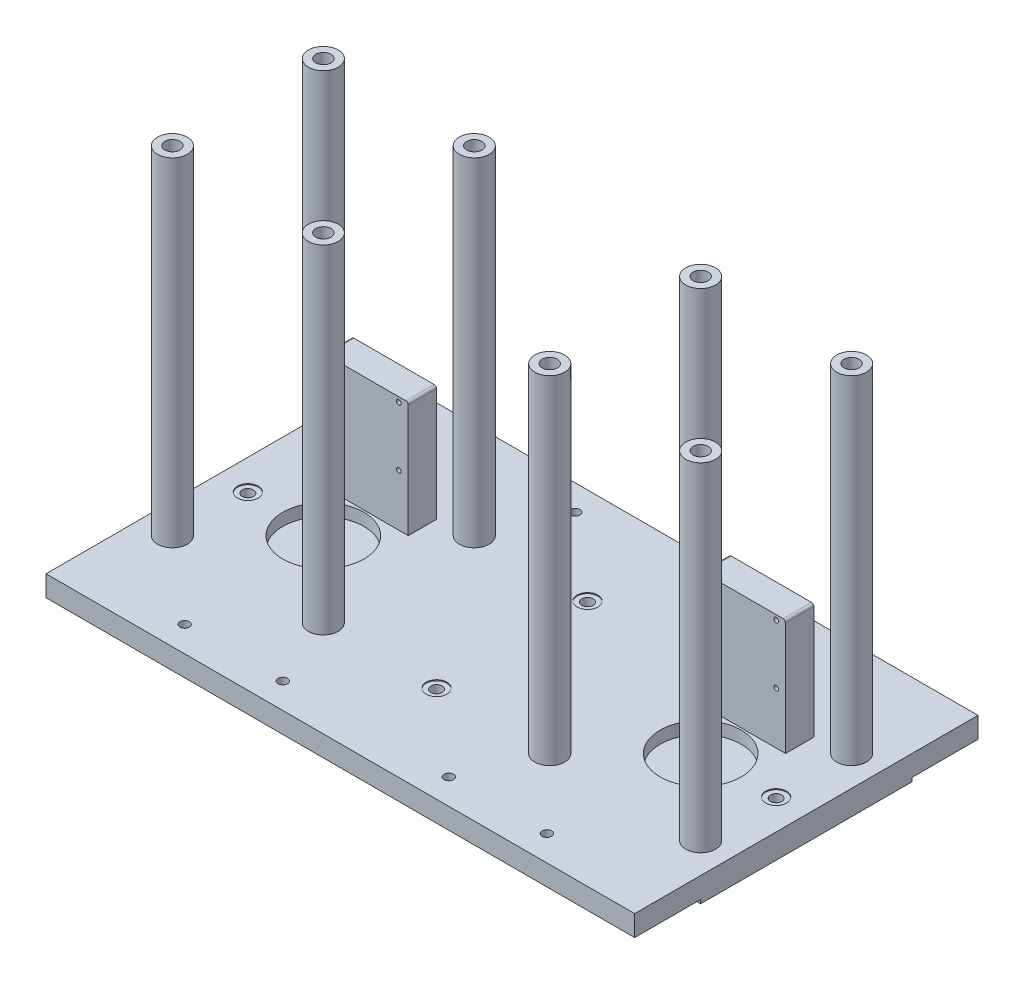
from build123d import *

# Parameters (mm, degrees)
SKETCH_1_W                    = 312
SKETCH_1_H                    = 112
EXTRUDE_1_DEPTH               = 2
SKETCH_2_W                    = 312
SKETCH_2_H                    = 182
EXTRUDE_2_DEPTH               = 11
SKETCH_3_R                    = 7.9
EXTRUDE_3_DEPTH               = 179
EXTRUDE_3_2_DEPTH             = 179
EXTRUDE_3_3_DEPTH             = 179
EXTRUDE_3_4_DEPTH             = 179
EXTRUDE_3_5_DEPTH             = 179
EXTRUDE_3_6_DEPTH             = 179
EXTRUDE_3_7_DEPTH             = 179
EXTRUDE_3_8_DEPTH             = 179
SKETCH_4_R                    = 21.5
CUT_EXTRUDE_2_DEPTH           = 6.5
HOLE_WIZARD_M5_1_AT_2_COUNT   = 2
HOLE_WIZARD_M5_1_AT_2_PITCH   = 52
HOLE_WIZARD_M5_1_AT_3_COUNT   = 2
HOLE_WIZARD_M5_1_AT_3_PITCH   = 163.49006086
HOLE_WIZARD_M5_1_AT_4_COUNT   = 2
HOLE_WIZARD_M5_1_AT_4_PITCH   = 155
HOLE_WIZARD_M5_1_2_AT_2_COUNT = 2
HOLE_WIZARD_M5_1_2_AT_2_PITCH = 145.602197786
HOLE_WIZARD_M5_1_2_AT_3_COUNT = 2
HOLE_WIZARD_M5_1_2_AT_3_PITCH = 145.602197786
HOLE_WIZARD_M5_1_2_AT_4_COUNT = 2
HOLE_WIZARD_M5_1_2_AT_4_PITCH = 280
HOLE_WIZARD_M8_1_AT_2_COUNT   = 2
HOLE_WIZARD_M8_1_AT_2_PITCH   = 80
HOLE_WIZARD_M8_1_AT_3_COUNT   = 2
HOLE_WIZARD_M8_1_AT_3_PITCH   = 113.13708499
HOLE_WIZARD_M8_1_AT_4_COUNT   = 2
HOLE_WIZARD_M8_1_AT_4_PITCH   = 80
HOLE_WIZARD_M8_1_AT_5_COUNT   = 2
HOLE_WIZARD_M8_1_AT_5_PITCH   = 200
HOLE_WIZARD_M8_1_AT_6_COUNT   = 2
HOLE_WIZARD_M8_1_AT_6_PITCH   = 280
HOLE_WIZARD_M8_1_AT_7_COUNT   = 2
HOLE_WIZARD_M8_1_AT_7_PITCH   = 291.204395571
HOLE_WIZARD_M8_1_AT_8_COUNT   = 2
HOLE_WIZARD_M8_1_AT_8_PITCH   = 215.406592285
SKETCH_31_W                   = 45
SKETCH_31_H                   = 15
EXTRUDE_4_DEPTH               = 61.25
SKETCH_32_R                   = 1.25
CUT_EXTRUDE_3_DEPTH           = 273.180546696
FILLET_1_R                    = 1.25
FILLET_1_OF_MIRROR_1_R        = 1.25


with BuildPart() as part:
    # 草图1 → 凸台-拉伸1 (new body)
    with BuildSketch(Plane(origin=(0, 0, 0), x_dir=(1, 0, 0), z_dir=(0, 1, 0))):
        Rectangle(SKETCH_1_W, SKETCH_1_H)
    extrude(amount=EXTRUDE_1_DEPTH)

    # 草图2 → 凸台-拉伸2 (add)
    with BuildSketch(Plane(origin=(0, 2, 0), x_dir=(1, 0, 0), z_dir=(0, 1, 0))):
        Rectangle(SKETCH_2_W, SKETCH_2_H)
    extrude(amount=EXTRUDE_2_DEPTH)

    # 草图4 → 切除-拉伸2 (cut)
    with BuildSketch(Plane(origin=(0, 13, 0), x_dir=(1, 0, 0), z_dir=(0, 1, 0))):
        with Locations(Location((-100, 0, 0), (0, 0, 270))):
            Circle(SKETCH_4_R)
        with Locations(Location((100, 0, 0), (0, 0, 270))):
            Circle(SKETCH_4_R)
    extrude(amount=-CUT_EXTRUDE_2_DEPTH, mode=Mode.SUBTRACT)

    # 草图7 → Hole Wizard M5 _1 (revolve, cut)
    with BuildSketch(Plane(origin=(-96, 13, -77.5), x_dir=(0, 0, 1), z_dir=(1, 0, 0))):
        Polygon((0, 0), (0, 11.002151548), (2.5, 9.5), (2.5, 0), align=None)
    hole_wizard_m5_1 = revolve(axis=Axis((-96, 19.35, -77.5), (0, -1, 0)), mode=Mode.SUBTRACT)

    # Hole Wizard M5 _1 at 2: Hole Wizard M5 _1 ×2
    with Locations(*[(i * HOLE_WIZARD_M5_1_AT_2_PITCH, 0, 0) for i in range(1, HOLE_WIZARD_M5_1_AT_2_COUNT)]):
        add(hole_wizard_m5_1, mode=Mode.SUBTRACT)

    # Hole Wizard M5 _1 at 3: Hole Wizard M5 _1 ×2
    with Locations(*[Vector(0.3180621484050644, 0, 0.9480698654381727) * (i * HOLE_WIZARD_M5_1_AT_3_PITCH) for i in range(1, HOLE_WIZARD_M5_1_AT_3_COUNT)]):
        add(hole_wizard_m5_1, mode=Mode.SUBTRACT)

    # Hole Wizard M5 _1 at 4: Hole Wizard M5 _1 ×2
    with Locations(*[(0, 0, i * HOLE_WIZARD_M5_1_AT_4_PITCH) for i in range(1, HOLE_WIZARD_M5_1_AT_4_COUNT)]):
        add(hole_wizard_m5_1, mode=Mode.SUBTRACT)

    # 草图26 → Hole Wizard M5 _1 2 (revolve, cut)
    with BuildSketch(Plane(origin=(-140, 13, 0), x_dir=(0, 0, 1), z_dir=(1, 0, 0))):
        Polygon((0, 0), (0, 13), (3, 13), (3, 0.5), (5.5, 0.5), (5.5, 0), align=None)
    hole_wizard_m5_1_2 = revolve(axis=Axis((-140, 19.35, 0), (0, -1, 0)), mode=Mode.SUBTRACT)

    # Hole Wizard M5 _1 2 at 2: Hole Wizard M5 _1 2 ×2
    with Locations(*[Vector(0.9615239476408232, 0, -0.274721127897378) * (i * HOLE_WIZARD_M5_1_2_AT_2_PITCH) for i in range(1, HOLE_WIZARD_M5_1_2_AT_2_COUNT)]):
        add(hole_wizard_m5_1_2, mode=Mode.SUBTRACT)

    # Hole Wizard M5 _1 2 at 3: Hole Wizard M5 _1 2 ×2
    with Locations(*[Vector(0.9615239476408232, 0, 0.274721127897378) * (i * HOLE_WIZARD_M5_1_2_AT_3_PITCH) for i in range(1, HOLE_WIZARD_M5_1_2_AT_3_COUNT)]):
        add(hole_wizard_m5_1_2, mode=Mode.SUBTRACT)

    # Hole Wizard M5 _1 2 at 4: Hole Wizard M5 _1 2 ×2
    with Locations(*[(i * HOLE_WIZARD_M5_1_2_AT_4_PITCH, 0, 0) for i in range(1, HOLE_WIZARD_M5_1_2_AT_4_COUNT)]):
        add(hole_wizard_m5_1_2, mode=Mode.SUBTRACT)

    # 草图31 → 凸台-拉伸4 (add)
    with BuildSketch(Plane(origin=(0, 13, 0), x_dir=(1, 0, 0), z_dir=(0, 1, 0))):
        with Locations((-100, 30)):
            Rectangle(SKETCH_31_W, SKETCH_31_H)
    extrude_4 = extrude(amount=EXTRUDE_4_DEPTH)

    # 草图32 → 切除-拉伸3 (cut, through all)
    with BuildSketch(Plane.XY.offset(-22.5)):
        with Locations((-117.5, 71.75)):
            Circle(SKETCH_32_R)
        with Locations((-82.5, 71.75)):
            Circle(SKETCH_32_R)
        with Locations((-82.5, 40.5)):
            Circle(SKETCH_32_R)
        with Locations((-117.5, 40.5)):
            Circle(SKETCH_32_R)
    cut_extrude_3 = extrude(amount=-CUT_EXTRUDE_3_DEPTH, mode=Mode.SUBTRACT)

    # 圆角1
    fillet_1_edges = [part.edges().sort_by_distance(p)[0] for p in [
        (-122.5, 74.25, -30),
        (-77.5, 74.25, -30),
    ]]
    fillet(fillet_1_edges, radius=FILLET_1_R)

    # 镜向1: Hole Wizard M5 _1, 凸台-拉伸4, 切除-拉伸3 across plane
    add(hole_wizard_m5_1.mirror(Plane(origin=(0, 0, 0), x_dir=(0, 0, 1), z_dir=(1, 0, 0))), mode=Mode.SUBTRACT)
    add(extrude_4.mirror(Plane(origin=(0, 0, 0), x_dir=(0, 0, 1), z_dir=(1, 0, 0))))
    add(cut_extrude_3.mirror(Plane(origin=(0, 0, 0), x_dir=(0, 0, 1), z_dir=(1, 0, 0))), mode=Mode.SUBTRACT)

    # 镜向1 copy 1 sketch → 镜向1 copy 1 (revolve, cut)
    with BuildSketch(Plane(origin=(44, 13, -77.5), x_dir=(0, 0, 1), z_dir=(-1, 0, 0))):
        Polygon((0, 0), (0, -11.002151548), (2.5, -9.5), (2.5, 0), align=None)
    revolve(axis=Axis((44, 19.35, -77.5), (0, 1, 0)), mode=Mode.SUBTRACT)

    # 镜向1 copy 2 sketch → 镜向1 copy 2 (revolve, cut)
    with BuildSketch(Plane(origin=(44, 13, 77.5), x_dir=(0, 0, 1), z_dir=(-1, 0, 0))):
        Polygon((0, 0), (0, -11.002151548), (2.5, -9.5), (2.5, 0), align=None)
    revolve(axis=Axis((44, 19.35, 77.5), (0, 1, 0)), mode=Mode.SUBTRACT)

    # 镜向1 copy 3 sketch → 镜向1 copy 3 (revolve, cut)
    with BuildSketch(Plane(origin=(96, 13, 77.5), x_dir=(0, 0, 1), z_dir=(-1, 0, 0))):
        Polygon((0, 0), (0, -11.002151548), (2.5, -9.5), (2.5, 0), align=None)
    revolve(axis=Axis((96, 19.35, 77.5), (0, 1, 0)), mode=Mode.SUBTRACT)

    # 圆角1 of 镜向1
    fillet_1_of_mirror_1_edges = [part.edges().sort_by_distance(p)[0] for p in [
        (122.5, 74.25, -30),
        (77.5, 74.25, -30),
    ]]
    fillet(fillet_1_of_mirror_1_edges, radius=FILLET_1_OF_MIRROR_1_R)


with BuildPart() as body_2:
    # 草图3 → 凸台-拉伸3 (new body)
    with BuildSketch(Plane(origin=(0, 13, 0), x_dir=(1, 0, 0), z_dir=(0, 1, 0))):
        with Locations(Location((-60, 40, 0), (0, 0, 90))):
            Circle(SKETCH_3_R)
    extrude(amount=EXTRUDE_3_DEPTH)


with BuildPart() as body_3:
    # 草图3 → Extrude 3 2 (new body)
    with BuildSketch(Plane(origin=(0, 13, 0), x_dir=(1, 0, 0), z_dir=(0, 1, 0))):
        with Locations(Location((60, 40, 0), (0, 0, 90))):
            Circle(SKETCH_3_R)
    extrude(amount=EXTRUDE_3_2_DEPTH)


with BuildPart() as body_4:
    # 草图3 → Extrude 3 3 (new body)
    with BuildSketch(Plane(origin=(0, 13, 0), x_dir=(1, 0, 0), z_dir=(0, 1, 0))):
        with Locations(Location((-60, -40, 0), (0, 0, 90))):
            Circle(SKETCH_3_R)
    extrude(amount=EXTRUDE_3_3_DEPTH)


with BuildPart() as body_5:
    # 草图3 → Extrude 3 4 (new body)
    with BuildSketch(Plane(origin=(0, 13, 0), x_dir=(1, 0, 0), z_dir=(0, 1, 0))):
        with Locations(Location((60, -40, 0), (0, 0, 90))):
            Circle(SKETCH_3_R)
    extrude(amount=EXTRUDE_3_4_DEPTH)


with BuildPart() as body_6:
    # 草图3 → Extrude 3 5 (new body)
    with BuildSketch(Plane(origin=(0, 13, 0), x_dir=(1, 0, 0), z_dir=(0, 1, 0))):
        with Locations(Location((-140, -40, 0), (0, 0, 90))):
            Circle(SKETCH_3_R)
    extrude(amount=EXTRUDE_3_5_DEPTH)


with BuildPart() as body_7:
    # 草图3 → Extrude 3 6 (new body)
    with BuildSketch(Plane(origin=(0, 13, 0), x_dir=(1, 0, 0), z_dir=(0, 1, 0))):
        with Locations(Location((-140, 40, 0), (0, 0, 90))):
            Circle(SKETCH_3_R)
    extrude(amount=EXTRUDE_3_6_DEPTH)

    # 草图28 → M8 螺纹孔的螺纹孔钻头1 (revolve, cut)
    with BuildSketch(Plane(origin=(-140, 192, -40), x_dir=(0, 0, 1), z_dir=(1, 0, 0))):
        Polygon((0, 0), (0, 15.403442476), (4, 13), (4, 0), align=None)
    hole_wizard_m8_1 = revolve(axis=Axis((-140, 198.35, -40), (0, -1, 0)), mode=Mode.SUBTRACT)


with BuildPart() as body_8:
    # 草图3 → Extrude 3 7 (new body)
    with BuildSketch(Plane(origin=(0, 13, 0), x_dir=(1, 0, 0), z_dir=(0, 1, 0))):
        with Locations(Location((140, 40, 0), (0, 0, 90))):
            Circle(SKETCH_3_R)
    extrude(amount=EXTRUDE_3_7_DEPTH)

    # M8 螺纹孔的螺纹孔钻头1 at 6: M8 螺纹孔的螺纹孔钻头1 ×2
    with Locations(*[(i * HOLE_WIZARD_M8_1_AT_6_PITCH, 0, 0) for i in range(1, HOLE_WIZARD_M8_1_AT_6_COUNT)]):
        add(hole_wizard_m8_1, mode=Mode.SUBTRACT)


with BuildPart() as body_9:
    # 草图3 → Extrude 3 8 (new body)
    with BuildSketch(Plane(origin=(0, 13, 0), x_dir=(1, 0, 0), z_dir=(0, 1, 0))):
        with Locations(Location((140, -40, 0), (0, 0, 90))):
            Circle(SKETCH_3_R)
    extrude(amount=EXTRUDE_3_8_DEPTH)

    # M8 螺纹孔的螺纹孔钻头1 at 7: M8 螺纹孔的螺纹孔钻头1 ×2
    with Locations(*[Vector(0.9615239476408232, 0, 0.274721127897378) * (i * HOLE_WIZARD_M8_1_AT_7_PITCH) for i in range(1, HOLE_WIZARD_M8_1_AT_7_COUNT)]):
        add(hole_wizard_m8_1, mode=Mode.SUBTRACT)


with BuildPart() as body_2_1:
    add(body_2.part)

    # M8 螺纹孔的螺纹孔钻头1 at 2: M8 螺纹孔的螺纹孔钻头1 ×2
    with Locations(*[(i * HOLE_WIZARD_M8_1_AT_2_PITCH, 0, 0) for i in range(1, HOLE_WIZARD_M8_1_AT_2_COUNT)]):
        add(hole_wizard_m8_1, mode=Mode.SUBTRACT)


with BuildPart() as body_4_1:
    add(body_4.part)

    # M8 螺纹孔的螺纹孔钻头1 at 3: M8 螺纹孔的螺纹孔钻头1 ×2
    with Locations(*[Vector(0.7071067811865475, 0, 0.7071067811865476) * (i * HOLE_WIZARD_M8_1_AT_3_PITCH) for i in range(1, HOLE_WIZARD_M8_1_AT_3_COUNT)]):
        add(hole_wizard_m8_1, mode=Mode.SUBTRACT)


with BuildPart() as body_6_1:
    add(body_6.part)

    # M8 螺纹孔的螺纹孔钻头1 at 4: M8 螺纹孔的螺纹孔钻头1 ×2
    with Locations(*[(0, 0, i * HOLE_WIZARD_M8_1_AT_4_PITCH) for i in range(1, HOLE_WIZARD_M8_1_AT_4_COUNT)]):
        add(hole_wizard_m8_1, mode=Mode.SUBTRACT)


with BuildPart() as body_3_1:
    add(body_3.part)

    # M8 螺纹孔的螺纹孔钻头1 at 5: M8 螺纹孔的螺纹孔钻头1 ×2
    with Locations(*[(i * HOLE_WIZARD_M8_1_AT_5_PITCH, 0, 0) for i in range(1, HOLE_WIZARD_M8_1_AT_5_COUNT)]):
        add(hole_wizard_m8_1, mode=Mode.SUBTRACT)


with BuildPart() as body_5_1:
    add(body_5.part)

    # M8 螺纹孔的螺纹孔钻头1 at 8: M8 螺纹孔的螺纹孔钻头1 ×2
    with Locations(*[Vector(0.9284766908852593, 0, 0.3713906763541037) * (i * HOLE_WIZARD_M8_1_AT_8_PITCH) for i in range(1, HOLE_WIZARD_M8_1_AT_8_COUNT)]):
        add(hole_wizard_m8_1, mode=Mode.SUBTRACT)


solid = Compound([part.part, body_7.part, body_8.part, body_9.part, body_2_1.part, body_4_1.part, body_6_1.part, body_3_1.part, body_5_1.part])
